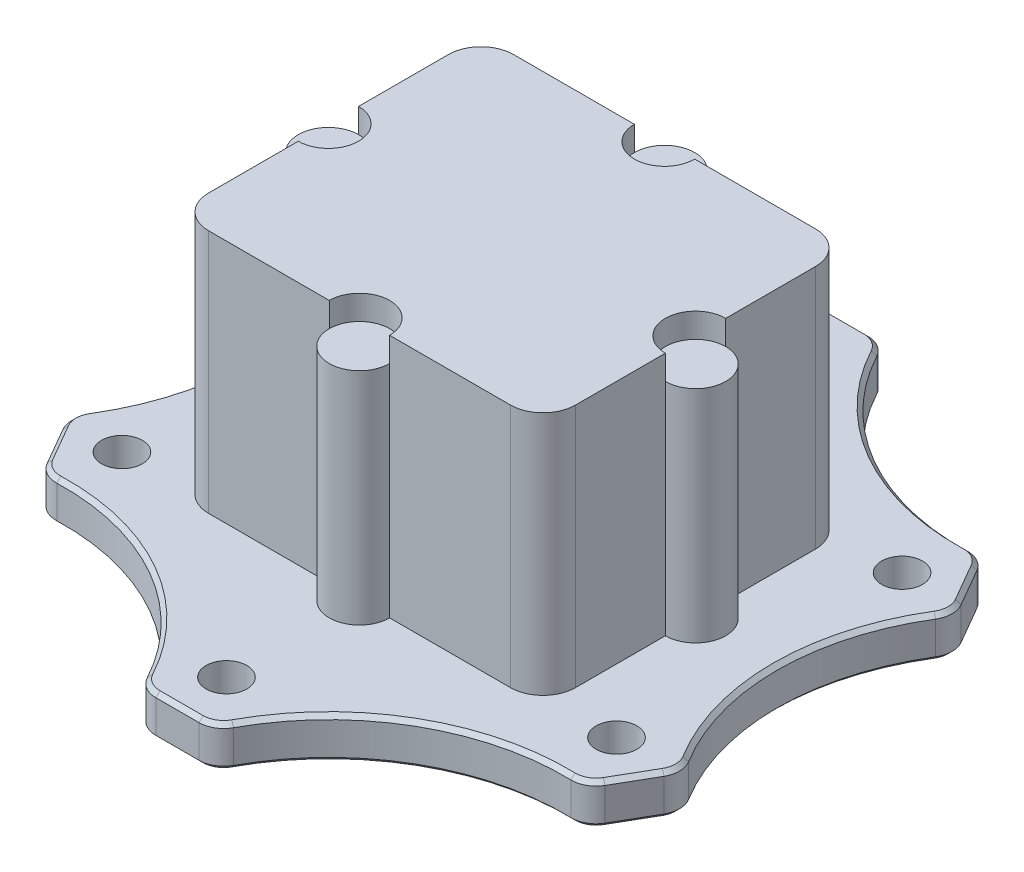
from build123d import *

# Parameters (mm, degrees)
BOSS_EXTRUDE1_DEPTH    = 5
F_10_CLEARANCE_HOLE1_D = 5
FILLET1_R              = 3
CHAMFER1_SIZE          = 0.5
BOSS_EXTRUDE4_DEPTH    = 30
SKETCH5_R              = 3.7
BOSS_EXTRUDE5_DEPTH    = 27


with BuildPart() as part:
    # Sketch1 → Boss-Extrude1 (new body)
    with BuildSketch(Plane.XZ.offset(-227)):
        with BuildLine():
            Line((610.472328875, 48.998023491), (619.472328875, 48.998023491))
            ThreePointArc((619.472328875, 48.998023491), (631.222328875, 61.852197868), (648.22937043, 65.600909174))
            Line((648.22937043, 65.600909174), (652.72937043, 73.395137808))
            ThreePointArc((652.72937043, 73.395137808), (647.472328875, 89.998023491), (652.72937043, 106.600909174))
            Line((652.72937043, 106.600909174), (648.22937043, 114.395137808))
            ThreePointArc((648.22937043, 114.395137808), (631.222328875, 118.143849114), (619.472328875, 130.998023491))
            Line((619.472328875, 130.998023491), (610.472328875, 130.998023491))
            ThreePointArc((610.472328875, 130.998023491), (598.722328875, 118.143849114), (581.71528732, 114.395137808))
            Line((581.71528732, 114.395137808), (577.21528732, 106.600909174))
            ThreePointArc((577.21528732, 106.600909174), (582.472328875, 89.998023491), (577.21528732, 73.395137808))
            Line((577.21528732, 73.395137808), (581.71528732, 65.600909174))
            ThreePointArc((581.71528732, 65.600909174), (598.722328875, 61.852197868), (610.472328875, 48.998023491))
        make_face()
    extrude(amount=-BOSS_EXTRUDE1_DEPTH)

    # #10 Clearance Hole1 (through all)
    with Locations(Plane(origin=(0, 232, 0), x_dir=(1, 0, 0), z_dir=(0, 1, 0))):
        with Locations((614.972328875, -124.998023491), (584.661439743, -72.498023491), (584.661439743, -107.498023491), (614.972328875, -54.998023491), (645.283218008, -107.498023491), (645.283218008, -72.498023491)):
            Hole(F_10_CLEARANCE_HOLE1_D / 2)

    # Fillet1
    fillet1_edges = [part.edges().sort_by_distance(p)[0] for p in [
        (581.71528732, 229.5, 65.600909174),
        (577.21528732, 229.5, 73.395137808),
        (577.21528732, 229.5, 106.600909174),
        (581.71528732, 229.5, 114.395137808),
        (610.472328875, 229.5, 130.998023491),
        (619.472328875, 229.5, 130.998023491),
        (648.22937043, 229.5, 114.395137808),
        (652.72937043, 229.5, 106.600909174),
        (652.72937043, 229.5, 73.395137808),
        (648.22937043, 229.5, 65.600909174),
        (619.472328875, 229.5, 48.998023491),
        (610.472328875, 229.5, 48.998023491),
    ]]
    fillet(fillet1_edges, radius=FILLET1_R)

    # Chamfer1
    chamfer1_edges = [part.edges().sort_by_distance(p)[0] for p in [
        (647.472328875, 227, 89.998023491),
        (647.472328875, 232, 89.998023491),
        (598.722328875, 227, 61.852197868),
        (614.972328875, 227, 48.998023491),
        (631.222328875, 227, 61.852197868),
        (650.47937043, 227, 69.498023491),
        (650.47937043, 227, 110.498023491),
        (631.222328875, 227, 118.143849114),
        (614.972328875, 227, 130.998023491),
        (598.722328875, 227, 118.143849114),
        (579.46528732, 227, 110.498023491),
        (582.472328875, 227, 89.998023491),
        (579.46528732, 227, 69.498023491),
        (581.92524679, 227, 113.911492617),
        (610.786198162, 227, 130.57437066),
        (610.786198162, 227, 49.421676322),
        (577.739116077, 227, 73.335145448),
        (619.158459588, 227, 49.421676322),
        (648.01941096, 227, 113.911492617),
        (619.158459588, 227, 130.57437066),
        (652.205541673, 227, 73.335145448),
        (648.01941096, 227, 66.084554366),
        (581.92524679, 227, 66.084554366),
        (577.739116077, 227, 106.660901535),
        (652.205541673, 227, 106.660901535),
        (650.47937043, 232, 110.498023491),
        (598.722328875, 232, 61.852197868),
        (579.46528732, 232, 69.498023491),
        (582.472328875, 232, 89.998023491),
        (579.46528732, 232, 110.498023491),
        (598.722328875, 232, 118.143849114),
        (614.972328875, 232, 130.998023491),
        (631.222328875, 232, 118.143849114),
        (650.47937043, 232, 69.498023491),
        (631.222328875, 232, 61.852197868),
        (614.972328875, 232, 48.998023491),
        (581.92524679, 232, 113.911492617),
        (610.786198162, 232, 130.57437066),
        (610.786198162, 232, 49.421676322),
        (577.739116077, 232, 73.335145448),
        (619.158459588, 232, 49.421676322),
        (648.01941096, 232, 113.911492617),
        (619.158459588, 232, 130.57437066),
        (652.205541673, 232, 73.335145448),
        (648.01941096, 232, 66.084554366),
        (581.92524679, 232, 66.084554366),
        (577.739116077, 232, 106.660901535),
        (652.205541673, 232, 106.660901535),
    ]]
    chamfer(chamfer1_edges, length=CHAMFER1_SIZE)

    # Sketch4 → Boss-Extrude4 (add)
    with BuildSketch(Plane(origin=(0, 232, 0), x_dir=(1, 0, 0), z_dir=(0, 1, 0))):
        with BuildLine():
            ThreePointArc((611.272328875, -108.698023491), (614.972328875, -104.998023491), (618.672328875, -108.698023491))
            Line((618.672328875, -108.698023491), (633.472328875, -108.698023491))
            ThreePointArc((633.472328875, -108.698023491), (636.300756, -107.526450616), (637.472328875, -104.698023491))
            Line((637.472328875, -104.698023491), (637.472328875, -93.698023491))
            ThreePointArc((637.472328875, -93.698023491), (633.772328875, -89.998023491), (637.472328875, -86.298023491))
            Line((637.472328875, -86.298023491), (637.472328875, -75.298023491))
            ThreePointArc((637.472328875, -75.298023491), (636.300756, -72.469596366), (633.472328875, -71.298023491))
            Line((633.472328875, -71.298023491), (618.672328875, -71.298023491))
            ThreePointArc((618.672328875, -71.298023491), (614.972328875, -74.998023491), (611.272328875, -71.298023491))
            Line((611.272328875, -71.298023491), (596.472328875, -71.298023491))
            ThreePointArc((596.472328875, -71.298023491), (593.64390175, -72.469596366), (592.472328875, -75.298023491))
            Line((592.472328875, -75.298023491), (592.472328875, -86.298023491))
            ThreePointArc((592.472328875, -86.298023491), (595.088623966, -87.381728401), (596.172328875, -89.998023491))
            ThreePointArc((596.172328875, -89.998023491), (595.088623966, -92.614318581), (592.472328875, -93.698023491))
            Line((592.472328875, -93.698023491), (592.472328875, -104.698023491))
            ThreePointArc((592.472328875, -104.698023491), (593.64390175, -107.526450616), (596.472328875, -108.698023491))
            Line((596.472328875, -108.698023491), (611.272328875, -108.698023491))
        make_face()
    extrude(amount=BOSS_EXTRUDE4_DEPTH)

    # Sketch5 → Boss-Extrude5 (add)
    with BuildSketch(Plane(origin=(0, 232, 0), x_dir=(1, 0, 0), z_dir=(0, 1, 0))):
        with Locations((614.972328875, -71.298023491)):
            Circle(SKETCH5_R)
        with Locations((637.472328875, -89.998023491)):
            Circle(SKETCH5_R)
        with Locations((614.972328875, -108.698023491)):
            Circle(SKETCH5_R)
        with Locations((592.472328875, -89.998023491)):
            Circle(SKETCH5_R)
    extrude(amount=BOSS_EXTRUDE5_DEPTH)


solid = part.part
